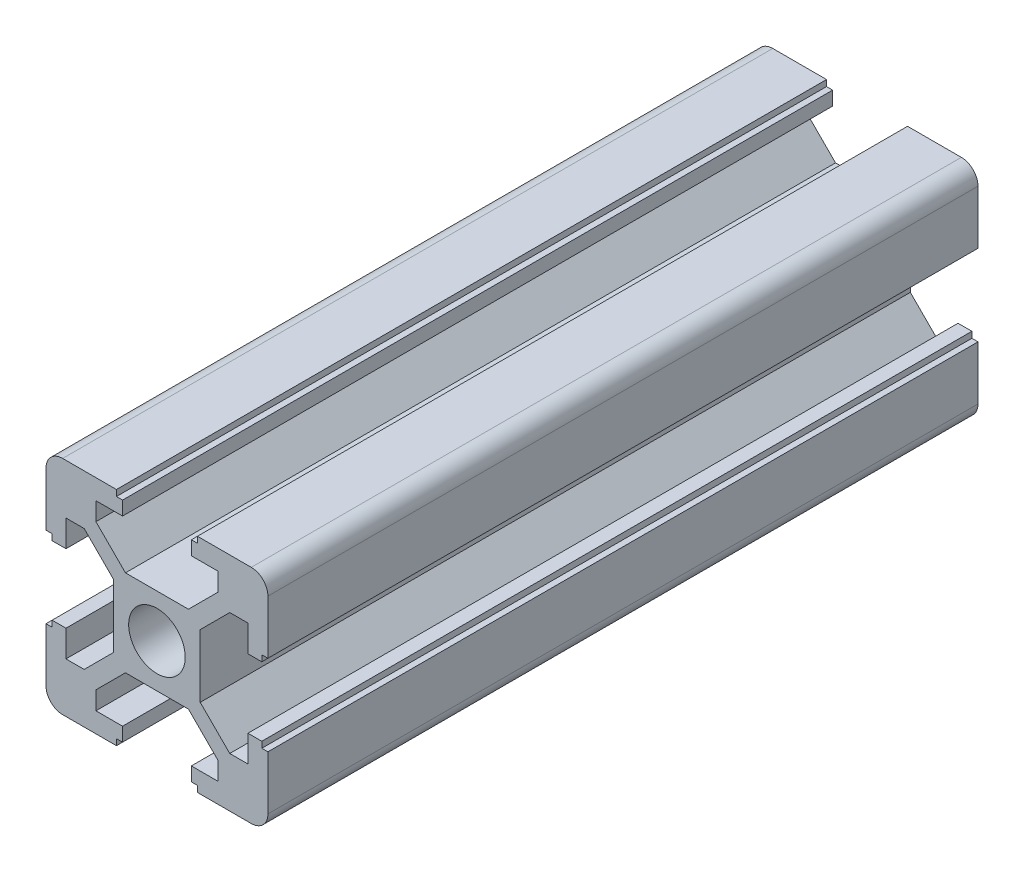
from build123d import *

# Parameters (mm, degrees)
SKETCH_1_R      = 2.55
EXTRUDE_1_DEPTH = 64


with BuildPart() as part:
    # 草图1 → 凸台-拉伸1 (new body)
    with BuildSketch(Plane.XY):
        with BuildLine():
            Line((-3.9, 2.839339828), (-6.560660172, 5.5))
            Line((-6.560660172, 5.5), (-8.2, 5.5))
            Line((-8.2, 5.5), (-8.2, 3.1))
            Line((-8.2, 3.1), (-9.45, 3.1))
            Line((-9.45, 3.1), (-9.45, 3.65))
            Line((-9.45, 3.65), (-10, 3.65))
            Line((-10, 3.65), (-10, 8.5))
            ThreePointArc((-10, 8.5), (-9.560660172, 9.560660172), (-8.5, 10))
            Line((-8.5, 10), (-3.65, 10))
            Line((-3.65, 10), (-3.65, 9.45))
            Line((-3.65, 9.45), (-3.1, 9.45))
            Line((-3.1, 9.45), (-3.1, 8.2))
            Line((-3.1, 8.2), (-5.5, 8.2))
            Line((-5.5, 8.2), (-5.5, 6.560660172))
            Line((-5.5, 6.560660172), (-2.839339828, 3.9))
            Line((-2.839339828, 3.9), (2.839339828, 3.9))
            Line((2.839339828, 3.9), (5.5, 6.560660172))
            Line((5.5, 6.560660172), (5.5, 8.2))
            Line((5.5, 8.2), (3.1, 8.2))
            Line((3.1, 8.2), (3.1, 9.45))
            Line((3.1, 9.45), (3.65, 9.45))
            Line((3.65, 9.45), (3.65, 10))
            Line((3.65, 10), (8.5, 10))
            ThreePointArc((8.5, 10), (9.560660172, 9.560660172), (10, 8.5))
            Line((10, 8.5), (10, 3.65))
            Line((10, 3.65), (9.45, 3.65))
            Line((9.45, 3.65), (9.45, 3.1))
            Line((9.45, 3.1), (8.2, 3.1))
            Line((8.2, 3.1), (8.2, 5.5))
            Line((8.2, 5.5), (6.560660172, 5.5))
            Line((6.560660172, 5.5), (3.9, 2.839339828))
            Line((3.9, 2.839339828), (3.9, -2.839339828))
            Line((3.9, -2.839339828), (6.560660172, -5.5))
            Line((6.560660172, -5.5), (8.2, -5.5))
            Line((8.2, -5.5), (8.2, -3.1))
            Line((8.2, -3.1), (9.45, -3.1))
            Line((9.45, -3.1), (9.45, -3.65))
            Line((9.45, -3.65), (10, -3.65))
            Line((10, -3.65), (10, -8.5))
            ThreePointArc((10, -8.5), (9.560660172, -9.560660172), (8.5, -10))
            Line((8.5, -10), (3.65, -10))
            Line((3.65, -10), (3.65, -9.45))
            Line((3.65, -9.45), (3.1, -9.45))
            Line((3.1, -9.45), (3.1, -8.2))
            Line((3.1, -8.2), (5.5, -8.2))
            Line((5.5, -8.2), (5.5, -6.560660172))
            Line((5.5, -6.560660172), (2.839339828, -3.9))
            Line((2.839339828, -3.9), (-2.839339828, -3.9))
            Line((-2.839339828, -3.9), (-5.5, -6.560660172))
            Line((-5.5, -6.560660172), (-5.5, -8.2))
            Line((-5.5, -8.2), (-3.1, -8.2))
            Line((-3.1, -8.2), (-3.1, -9.45))
            Line((-3.1, -9.45), (-3.65, -9.45))
            Line((-3.65, -9.45), (-3.65, -10))
            Line((-3.65, -10), (-8.5, -10))
            ThreePointArc((-8.5, -10), (-9.560660172, -9.560660172), (-10, -8.5))
            Line((-10, -8.5), (-10, -3.65))
            Line((-10, -3.65), (-9.45, -3.65))
            Line((-9.45, -3.65), (-9.45, -3.1))
            Line((-9.45, -3.1), (-8.2, -3.1))
            Line((-8.2, -3.1), (-8.2, -5.5))
            Line((-8.2, -5.5), (-6.560660172, -5.5))
            Line((-6.560660172, -5.5), (-3.9, -2.839339828))
            Line((-3.9, -2.839339828), (-3.9, 2.839339828))
        make_face()
        Circle(SKETCH_1_R, mode=Mode.SUBTRACT)
    extrude(amount=EXTRUDE_1_DEPTH)


solid = part.part
